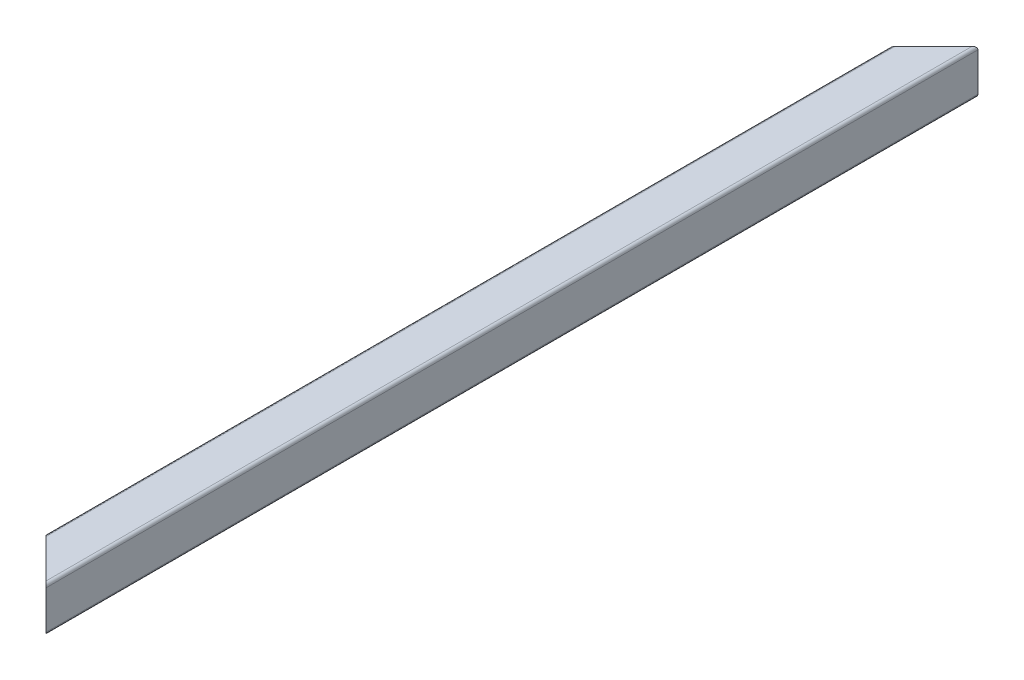
from build123d import *

# Parameters (mm, degrees)
Y_KSEKLIK_EKSTR_ZYON1_DEPTH      = 315
Y_KSEKLIK_EKSTR_ZYON1_DEPTH_BACK = 315
IZIM1_W                          = 26
IZIM1_H                          = 26
KES_EKSTR_ZYON1_DEPTH            = 250
KES_EKSTR_ZYON1_DEPTH_BACK       = 250


with BuildPart() as part:
    # Çizim1 → Yükseklik-Ekstrüzyon1 (new, two sides: drawn at the far end of the back side and taken through both)
    with BuildSketch(Plane.XY.offset(-Y_KSEKLIK_EKSTR_ZYON1_DEPTH_BACK)):
        with BuildLine():
            Line((-13, 15), (13, 15))
            ThreePointArc((13, 15), (14.414213562, 14.414213562), (15, 13))
            Line((15, 13), (15, -13))
            ThreePointArc((15, -13), (14.414213562, -14.414213562), (13, -15))
            Line((13, -15), (-13, -15))
            ThreePointArc((-13, -15), (-14.414213562, -14.414213562), (-15, -13))
            Line((-15, -13), (-15, 13))
            ThreePointArc((-15, 13), (-14.414213562, 14.414213562), (-13, 15))
        make_face()
        Rectangle(IZIM1_W, IZIM1_H, mode=Mode.SUBTRACT)
    extrude(amount=Y_KSEKLIK_EKSTR_ZYON1_DEPTH + Y_KSEKLIK_EKSTR_ZYON1_DEPTH_BACK)

    # Çizim2 → Kes-Ekstrüzyon1 (cut, two sides: drawn at the far end of the back side and taken through both)
    with BuildSketch(Plane(origin=(0, 0, 0), x_dir=(1, 0, 0), z_dir=(0, 1, 0)).offset(-KES_EKSTR_ZYON1_DEPTH_BACK)):
        Polygon((15, 315), (-15, 285), (-15, 315), align=None)
        Polygon((15, -315), (-15, -285), (-15, -315), align=None)
    extrude(amount=KES_EKSTR_ZYON1_DEPTH + KES_EKSTR_ZYON1_DEPTH_BACK, mode=Mode.SUBTRACT)


solid = part.part
